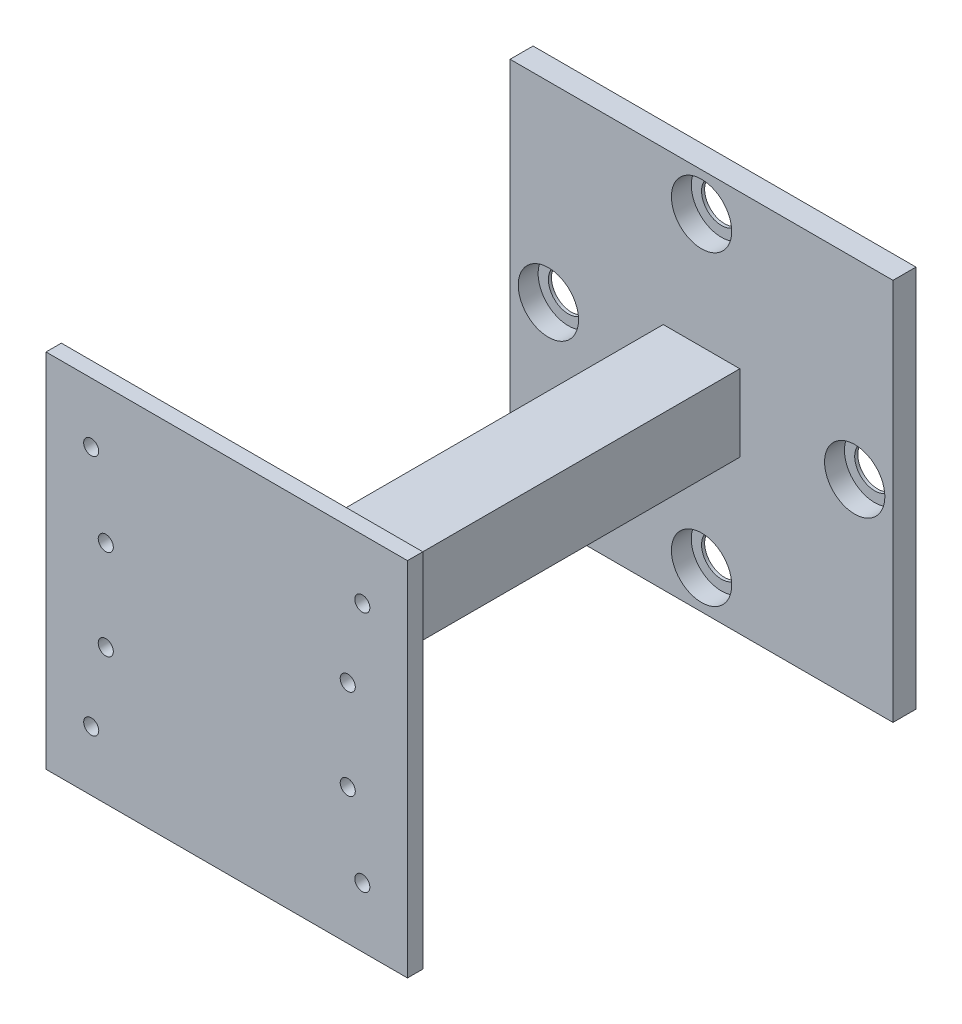
from build123d import *

# Parameters (mm, degrees)
SKETCH2_W                       = 63.5
SKETCH2_H                       = 63.5
BOSS_EXTRUDE2_DEPTH             = 3.81
SKETCH3_W                       = 12.7
SKETCH3_H                       = 12.7
BOSS_EXTRUDE3_DEPTH             = 76.2
SKETCH14_W                      = 59.944
SKETCH14_H                      = 59.944
BOSS_EXTRUDE6_DEPTH             = 2.54
CBORE_FOR_M6_SBHCS2_D           = 6.6
CBORE_FOR_M6_SBHCS2_DEPTH       = 7.62
CBORE_FOR_M6_SBHCS2_CBORE_D     = 10
CBORE_FOR_M6_SBHCS2_CBORE_DEPTH = 3.3
CBORE_FOR_M6_SBHCS2_TIP         = 1.982840043
TAP_DRILL_FOR_M3X0_5_TAP2_D     = 2.5
TAP_DRILL_FOR_M3X0_5_TAP2_DEPTH = 7.62
TAP_DRILL_FOR_M3X0_5_TAP2_TIP   = 0.751075774


with BuildPart() as part:
    # Sketch2 → Boss-Extrude2 (new body)
    with BuildSketch(Plane.XY):
        with Locations((31.75, 31.75)):
            Rectangle(SKETCH2_W, SKETCH2_H)
    extrude(amount=BOSS_EXTRUDE2_DEPTH)

    # Sketch3 → Boss-Extrude3 (add)
    with BuildSketch(Plane.XY.offset(3.81)):
        with Locations((31.75, 31.75)):
            Rectangle(SKETCH3_W, SKETCH3_H)
    extrude(amount=BOSS_EXTRUDE3_DEPTH)

    # Sketch14 → Boss-Extrude6 (add)
    with BuildSketch(Plane.XY.offset(80.01)):
        with Locations((31.75, 31.75)):
            Rectangle(SKETCH14_W, SKETCH14_H)
    extrude(amount=BOSS_EXTRUDE6_DEPTH)

    # CBORE for M6 SBHCS2
    with Locations(Plane.XY.offset(3.81)):
        with Locations((57.15, 31.75), (31.75, 6.35), (31.75, 57.15), (6.35, 31.75)):
            CounterBoreHole(CBORE_FOR_M6_SBHCS2_D / 2, CBORE_FOR_M6_SBHCS2_CBORE_D / 2, CBORE_FOR_M6_SBHCS2_CBORE_DEPTH, depth=CBORE_FOR_M6_SBHCS2_DEPTH)
            with Locations((0, 0, -(CBORE_FOR_M6_SBHCS2_DEPTH + CBORE_FOR_M6_SBHCS2_TIP / 2))):  # 118° drill point
                Cone(0, CBORE_FOR_M6_SBHCS2_D / 2, CBORE_FOR_M6_SBHCS2_TIP, mode=Mode.SUBTRACT)

    # Tap Drill for M3x0.5 Tap2
    with Locations(Plane.XY.offset(82.55)):
        with Locations((9.271, 51.816), (9.271, 11.684), (54.229, 11.684), (54.229, 51.816), (11.684, 39.243), (11.684, 24.257), (51.816, 39.243), (51.816, 24.257)):
            Hole(TAP_DRILL_FOR_M3X0_5_TAP2_D / 2, depth=TAP_DRILL_FOR_M3X0_5_TAP2_DEPTH)
            with Locations((0, 0, -(TAP_DRILL_FOR_M3X0_5_TAP2_DEPTH + TAP_DRILL_FOR_M3X0_5_TAP2_TIP / 2))):  # 118° drill point
                Cone(0, TAP_DRILL_FOR_M3X0_5_TAP2_D / 2, TAP_DRILL_FOR_M3X0_5_TAP2_TIP, mode=Mode.SUBTRACT)


solid = part.part
